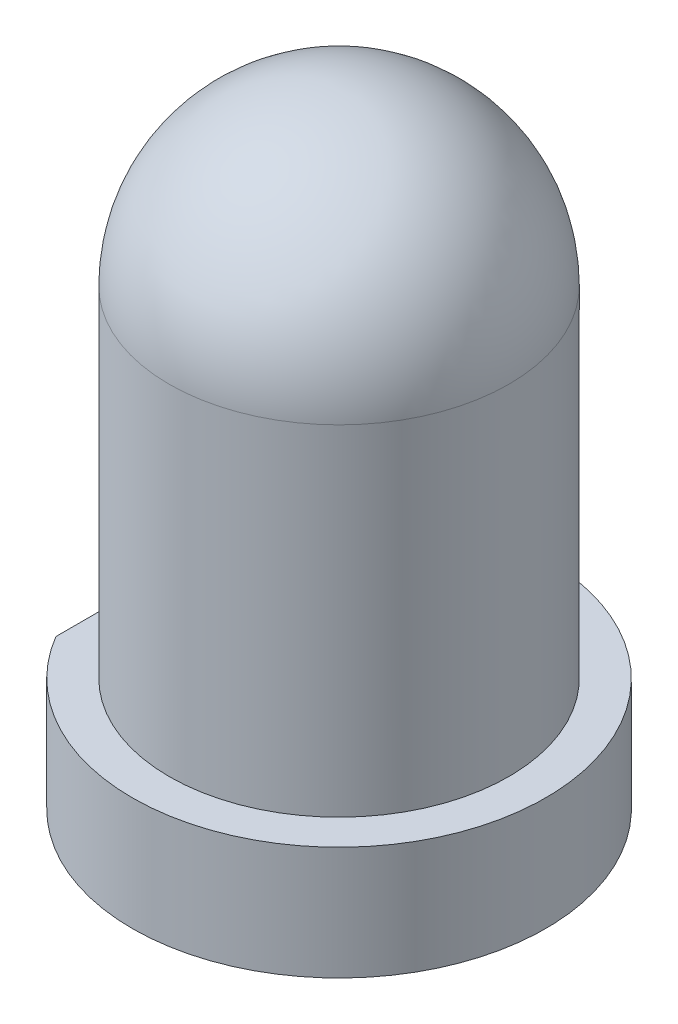
from build123d import *

# Parameters (mm, degrees)
CUT_EXTRUDE2_DEPTH      = 7.075462945
CUT_EXTRUDE2_DEPTH_BACK = 10


with BuildPart() as part:
    # Sketch1 → Revolve1 (revolve)
    with BuildSketch(Plane.XY, mode=Mode.PRIVATE) as revolve1_sk:
        with BuildLine():
            Line((0, 0), (1.825, 0))
            Line((1.825, 0), (1.825, 1))
            Line((1.825, 1), (1.5, 1))
            Line((1.5, 1), (1.5, 4))
            ThreePointArc((1.5, 4), (1.060660172, 5.060660172), (0, 5.5))
            Line((0, 5.5), (0, 0))
        make_face()
    revolve(revolve1_sk.sketch.rotate(Axis((0, 5.831246109, 0), (0, -1, 0)), 90), axis=Axis((0, 5.831246109, 0), (0, -1, 0)))

    # Sketch2 → Cut-Extrude2 (cut, two sides: drawn at the far end of the back side and taken through both)
    with BuildSketch(Plane(origin=(0, 0, 0), x_dir=(1, 0, 0), z_dir=(0, 1, 0)).offset(-CUT_EXTRUDE2_DEPTH_BACK)):
        Polygon((-1.570919179, 1.389855442), (-1.570919179, -1.604071694), (-2.626699276, -0.267770315), align=None)
    extrude(amount=CUT_EXTRUDE2_DEPTH + CUT_EXTRUDE2_DEPTH_BACK, mode=Mode.SUBTRACT)


solid = part.part
